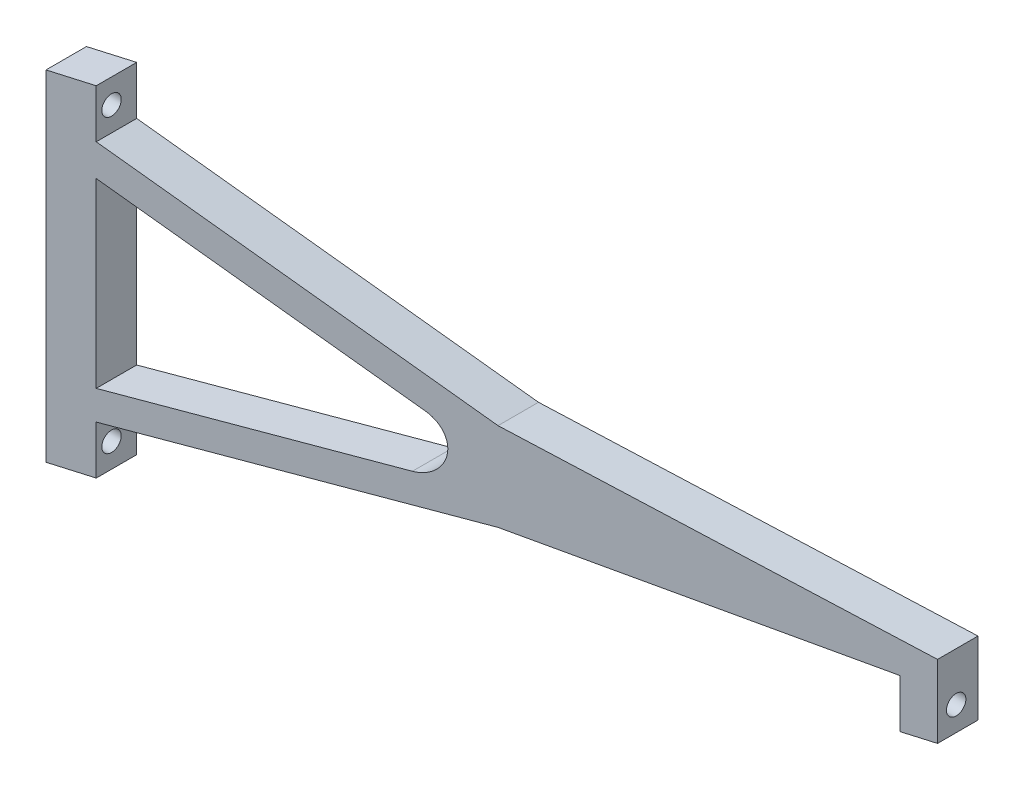
from build123d import *

# Parameters (mm, degrees)
EXTRUDE_1_DEPTH     = 30
SKETCH_2_OUTSIDE_W  = 177.86
SKETCH_2_OUTSIDE_H  = 95.86
CUT_EXTRUDE_2_DEPTH = 105.804580053
SKETCH_3_R          = 2
CUT_EXTRUDE_3_DEPTH = 155.129815415
CUT_EXTRUDE_4_REACH = 163.133
SKETCH_4_R          = 2


with BuildPart() as part:
    # 草图1 → 凸台-拉伸1 (new, symmetric)
    with BuildSketch(Plane.XY):
        Polygon((64, 10), (64, 0), (70, 0), (70, 15), (0, 31.968692331), (-64, 60), (-64, 70), (-72, 70), (-72, 0), (-64, 0), (-64, 10), (0, 13.812766908), align=None)
        with BuildLine():
            Line((-64, 53.449729558), (-64, 16.010637927))
            Line((-64, 16.010637927), (-13.64318573, 19.010619099))
            ThreePointArc((-13.64318573, 19.010619099), (-8.09338134, 23.945554173), (-11.592830601, 30.495956285))
            Line((-11.592830601, 30.495956285), (-64, 53.449729558))
        make_face(mode=Mode.SUBTRACT)
    extrude(amount=EXTRUDE_1_DEPTH, both=True)

    # 草图2 outside → 切除-拉伸2 (cut, through all)
    with BuildSketch(Plane(origin=(0, 0, 0), x_dir=(1, 0, 0), z_dir=(0, 1, 0))):
        with Locations((-1, 0)):
            Rectangle(SKETCH_2_OUTSIDE_W, SKETCH_2_OUTSIDE_H)
        Polygon((70, 30), (70, 21.662773788), (-72, -20), (-72, -11.662773788), align=None, mode=Mode.SUBTRACT)
    extrude(amount=CUT_EXTRUDE_2_DEPTH, mode=Mode.SUBTRACT)

    # 草图3 → 切除-拉伸3 (cut, through all)
    with BuildSketch(Plane(origin=(-64, 0, 0), x_dir=(0, 0, -1), z_dir=(1, 0, 0))):
        with Locations((-14.5, 65)):
            Circle(SKETCH_3_R)
        with Locations((-14.5, 5)):
            Circle(SKETCH_3_R)
    extrude(amount=-CUT_EXTRUDE_3_DEPTH, mode=Mode.SUBTRACT)

    # 草图4 → 切除-拉伸4 (cut, up to next)
    with BuildSketch(Plane(origin=(70, 0, 0), x_dir=(0, 0, -1), z_dir=(1, 0, 0)), mode=Mode.PRIVATE) as cut_extrude_4_sk1:
        with Locations((25.5, 5)):
            Circle(SKETCH_4_R)
    cut_extrude_4_tool1 = extrude(cut_extrude_4_sk1.sketch, amount=-CUT_EXTRUDE_4_REACH, mode=Mode.PRIVATE) & part.part
    add(cut_extrude_4_tool1.solids().sort_by_distance((70, 5, -25.5))[0], mode=Mode.SUBTRACT)


solid = part.part
